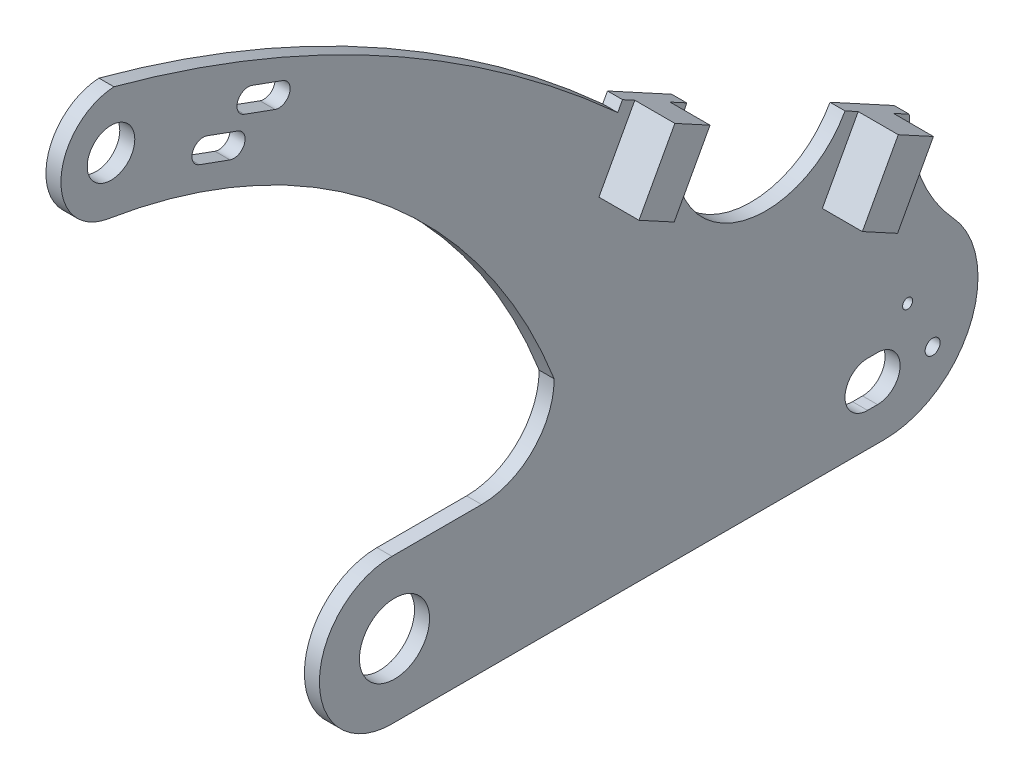
from build123d import *

# Parameters (mm, degrees)
SKETCH1_R           = 1.5
SKETCH1_R_2         = 1
SKETCH1_R_3         = 7
SKETCH1_R_4         = 4.75
BOSS_EXTRUDE1_DEPTH = 3
BOSS_EXTRUDE2_DEPTH = 8


with BuildPart() as part:
    # Sketch1 → Boss-Extrude1 (new body)
    with BuildSketch(Plane(origin=(0, 0, 0), x_dir=(0, 0, -1), z_dir=(1, 0, 0))):
        with BuildLine():
            Line((-49.159345461, 0), (49.159345461, 0))
            ThreePointArc((49.159345461, 0), (66.340654539, 11.242329364), (62.91845049, 31.487720707))
            ThreePointArc((62.91845049, 31.487720707), (56.432557087, 41.829379484), (54.166473214, 53.824444444))
            Line((54.166473214, 53.824444444), (41.340654539, 60.8))
            ThreePointArc((41.340654539, 60.8), (16.928001378, 53.587346839), (9.715348216, 78))
            Line((9.715348216, 78), (-3.110470459, 84.975555556))
            Line((-3.110470459, 84.975555556), (-4.066026015, 83.218594093))
            ThreePointArc((-4.066026015, 83.218594093), (-51.126972403, 116.596460909), (-104.705915866, 138))
            ThreePointArc((-104.705915866, 138), (-115.275757126, 127.38864025), (-105.87300769, 115.730561375))
            ThreePointArc((-105.87300769, 115.730561375), (-51.706077225, 91.471635272), (-16.759345461, 43.5))
            ThreePointArc((-16.759345461, 43.5), (-21.006297134, 33.246951673), (-31.259345461, 29))
            Line((-31.259345461, 29), (-49.159345461, 29))
            ThreePointArc((-49.159345461, 29), (-63.659345461, 14.5), (-49.159345461, 0))
        make_face()
        with Locations((58.840654539, 11.242329364)):
            Circle(SKETCH1_R, mode=Mode.SUBTRACT)
        with Locations((53.840654539, 21.242329364)):
            Circle(SKETCH1_R_2, mode=Mode.SUBTRACT)
        with Locations((-48.659345461, 14.5)):
            Circle(SKETCH1_R_3, mode=Mode.SUBTRACT)
        with Locations((-105.289461778, 126.865280687)):
            Circle(SKETCH1_R_4, mode=Mode.SUBTRACT)
        with BuildLine():
            Line((45.840654539, 15.742329364), (47.840654539, 15.742329364))
            ThreePointArc((47.840654539, 15.742329364), (52.340654539, 11.242329364), (47.840654539, 6.742329364))
            Line((47.840654539, 6.742329364), (45.840654539, 6.742329364))
            ThreePointArc((45.840654539, 6.742329364), (41.340654539, 11.242329364), (45.840654539, 15.742329364))
        make_face(mode=Mode.SUBTRACT)
        with BuildLine():
            Line((-86.096000708, 120.210043762), (-79.987998673, 117.98691283))
            ThreePointArc((-79.987998673, 117.98691283), (-78.643235599, 115.103059111), (-81.527089318, 113.758296037))
            Line((-81.527089318, 113.758296037), (-87.635091353, 115.981426968))
            ThreePointArc((-87.635091353, 115.981426968), (-88.979854428, 118.865280687), (-86.096000708, 120.210043762))
        make_face(mode=Mode.SUBTRACT)
        with BuildLine():
            Line((-77.104144954, 124.438660555), (-70.996142919, 122.215529624))
            ThreePointArc((-70.996142919, 122.215529624), (-69.651379845, 119.331675904), (-72.535233564, 117.98691283))
            Line((-72.535233564, 117.98691283), (-78.643235599, 120.210043762))
            ThreePointArc((-78.643235599, 120.210043762), (-79.987998673, 123.093897481), (-77.104144954, 124.438660555))
        make_face(mode=Mode.SUBTRACT)
    extrude(amount=BOSS_EXTRUDE1_DEPTH)

    # Sketch2 → Boss-Extrude2 (add)
    with BuildSketch(Plane(origin=(3, 0, 0), x_dir=(0, 0, -1), z_dir=(1, 0, 0))):
        Polygon((43.976096732, 59.366666667), (51.003942582, 55.544444444), (43.837275915, 42.367233477), (36.809430066, 46.189455699), align=None)
        Polygon((-0.650724412, 83.637777778), (6.377121438, 79.815555556), (-0.789545229, 66.638344588), (-7.817391078, 70.46056681), align=None)
    extrude(amount=BOSS_EXTRUDE2_DEPTH)


solid = part.part
